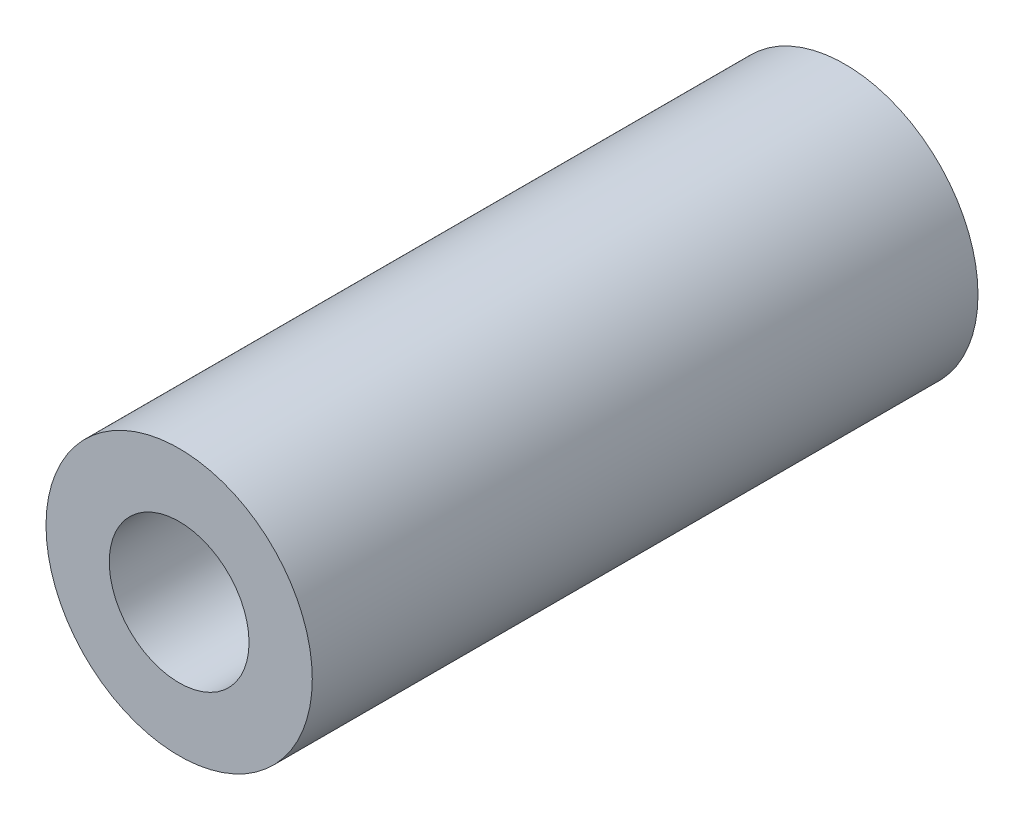
from build123d import *

# Parameters (mm, degrees)
SKETCH1_R      = 4
SKETCH1_R_2    = 2.1
EXTRUDE1_DEPTH = 10


with BuildPart() as part:
    # Sketch1 → Extrude1 (new, symmetric)
    with BuildSketch(Plane.XY):
        Circle(SKETCH1_R)
        Circle(SKETCH1_R_2, mode=Mode.SUBTRACT)
    extrude(amount=EXTRUDE1_DEPTH, both=True)


solid = part.part
